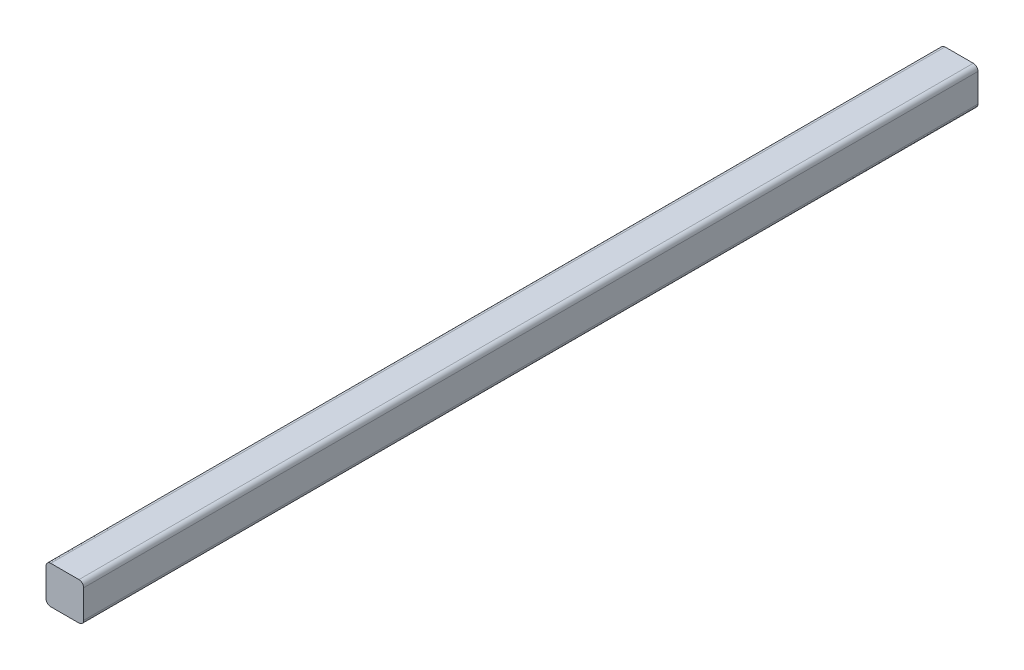
from build123d import *

# Parameters (mm, degrees)
SKETCH3_W           = 4
SKETCH3_H           = 4
BOSS_EXTRUDE1_DEPTH = 95
FILLET1_R           = 0.5


with BuildPart() as part:
    # Sketch3 → Boss-Extrude1 (new body)
    with BuildSketch(Plane.XY):
        Rectangle(SKETCH3_W, SKETCH3_H)
    extrude(amount=BOSS_EXTRUDE1_DEPTH)

    # Fillet1
    fillet1_edges = [part.edges().sort_by_distance(p)[0] for p in [
        (-2, 2, 47.5),
        (2, 2, 47.5),
        (2, -2, 47.5),
        (-2, -2, 47.5),
    ]]
    fillet(fillet1_edges, radius=FILLET1_R)


solid = part.part
